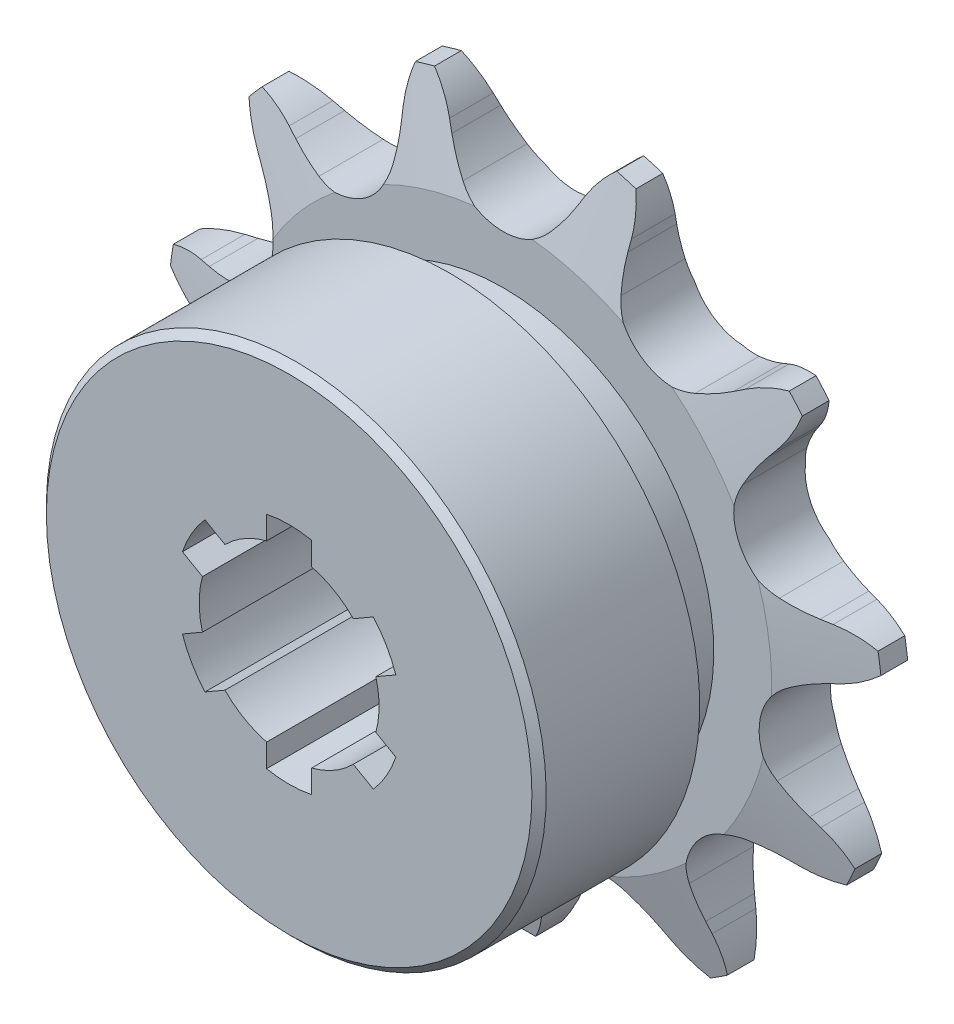
from build123d import *

# Parameters (mm, degrees)
CUT_EXTRUDE1_DEPTH      = 46.077076136
CIRPATTERN1_COUNT       = 11
BOSS_EXTRUDE1_START     = 3.175
SKETCH2_R               = 22.225
BOSS_EXTRUDE1_DEPTH     = 19.05
CUT_EXTRUDE2_DEPTH      = 51.025371879
CUT_EXTRUDE2_DEPTH_BACK = 51.025371879
SKETCH3_R               = 7.9375
SKETCH4_W               = 4.7625
SKETCH4_H               = 13.081
SKETCH5_R               = 7.9375
CUT_EXTRUDE3_DEPTH      = 52.514533936


with BuildPart() as part:
    # Sketch1 → Revolve1 (revolve)
    with BuildSketch(Plane(origin=(0, 0, 0), x_dir=(0, 0, -1), z_dir=(1, 0, 0)), mode=Mode.PRIVATE) as revolve1_sk:
        Polygon((3.175, 0), (-3.175, 0), (-3.175, 23.857642459), (-1.190625, 31.795142459), (1.190625, 31.795142459), (3.175, 23.857642459), align=None)
    revolve(revolve1_sk.sketch.rotate(Axis((0, 0, -3.175), (0, 0, 1)), 90), axis=Axis((0, 0, -3.175), (0, 0, 1)))

    # Sketch0 → Cut-Extrude1 (cut, symmetric)
    with BuildSketch(Plane.XY):
        with BuildLine():
            Line((13.704056458, -25.310310757), (13.050398427, -24.631275233))
            ThreePointArc((13.050398427, -24.631275233), (11.95512537, -23.614779328), (10.752525531, -22.727851696))
            ThreePointArc((10.752525531, -22.727851696), (6.488408594, -22.097490349), (3.24200423, -24.933139726))
            ThreePointArc((3.24200423, -24.933139726), (2.709822147, -26.329445289), (2.337978996, -27.776725382))
            Line((2.337978996, -27.776725382), (2.155201188, -28.701360627))
            ThreePointArc((2.155201188, -28.701360627), (-1.617083023, -34.260607897), (-8.235613288, -35.414044291))
            ThreePointArc((-8.235613288, -35.414044291), (10.243525573, -34.886244325), (26.074516628, -25.339681171))
            ThreePointArc((26.074516628, -25.339681171), (19.883059866, -27.947596343), (13.704056458, -25.310310757))
        make_face()
    cut_extrude1 = extrude(amount=CUT_EXTRUDE1_DEPTH, both=True, mode=Mode.SUBTRACT)

    # CirPattern1: Cut-Extrude1 ×11 about axis
    cirpattern1_axis = Axis((0, 0, 0), (0, 0, 1))
    for i in range(1, CIRPATTERN1_COUNT):
        add(cut_extrude1.rotate(cirpattern1_axis, i * 360 / CIRPATTERN1_COUNT), mode=Mode.SUBTRACT)

    # Sketch2 → Boss-Extrude1 (add)
    with BuildSketch(Plane.XY.offset(BOSS_EXTRUDE1_START)):
        Circle(SKETCH2_R)
    extrude(amount=BOSS_EXTRUDE1_DEPTH)

    # Sketch3 → Cut-Extrude2 (cut, two sides: drawn at the far end of the back side and taken through both)
    with BuildSketch(Plane.XY.offset(-CUT_EXTRUDE2_DEPTH_BACK)):
        Circle(SKETCH3_R)
    extrude(amount=CUT_EXTRUDE2_DEPTH + CUT_EXTRUDE2_DEPTH_BACK, mode=Mode.SUBTRACT)

    # Sketch4 → Cut-Revolve1 (revolve, cut)
    with BuildSketch(Plane(origin=(0, 0, 0), x_dir=(0, 0, -1), z_dir=(1, 0, 0))):
        Polygon((-22.225, 22.225), (-22.225, 21.59), (-21.59, 22.225), align=None)
        with Locations((-5.55625, 25.254642459)):
            Rectangle(SKETCH4_W, SKETCH4_H)
    revolve(axis=Axis((0, 0, -3.175), (0, 0, 1)), mode=Mode.SUBTRACT)

    # Sketch5 → Cut-Extrude3 (cut, through all)
    with BuildSketch(Plane(origin=(0, 0, -3.175), x_dir=(-1, 0, 0), z_dir=(0, 0, -1))):
        with BuildLine():
            ThreePointArc((7.485281374, -6.631030293), (8.660254038, -5), (9.485281374, -3.166928678))
            Line((9.485281374, -3.166928678), (7.708203933, -2.140932539))
            ThreePointArc((7.708203933, -2.140932539), (8, 0), (7.708203933, 2.140932539))
            Line((7.708203933, 2.140932539), (9.485281374, 3.166928678))
            ThreePointArc((9.485281374, 3.166928678), (8.660254038, 5), (7.485281374, 6.631030293))
            Line((7.485281374, 6.631030293), (5.708203933, 5.605034154))
            ThreePointArc((5.708203933, 5.605034154), (4, 6.92820323), (2, 7.745966692))
            Line((2, 7.745966692), (2, 9.797958971))
            ThreePointArc((2, 9.797958971), (0, 10), (-2, 9.797958971))
            Line((-2, 9.797958971), (-2, 7.745966692))
            ThreePointArc((-2, 7.745966692), (-4, 6.92820323), (-5.708203932, 5.605034154))
            Line((-5.708203932, 5.605034154), (-7.485281374, 6.631030293))
            ThreePointArc((-7.485281374, 6.631030293), (-8.660254038, 5), (-9.485281374, 3.166928678))
            Line((-9.485281374, 3.166928678), (-7.708203932, 2.140932539))
            ThreePointArc((-7.708203932, 2.140932539), (-8, 0), (-7.708203932, -2.140932539))
            Line((-7.708203932, -2.140932539), (-9.485281374, -3.166928678))
            ThreePointArc((-9.485281374, -3.166928678), (-8.660254038, -5), (-7.485281374, -6.631030293))
            Line((-7.485281374, -6.631030293), (-5.708203932, -5.605034154))
            ThreePointArc((-5.708203932, -5.605034154), (-4, -6.92820323), (-2, -7.745966692))
            Line((-2, -7.745966692), (-2, -9.797958971))
            ThreePointArc((-2, -9.797958971), (0, -10), (2, -9.797958971))
            Line((2, -9.797958971), (2, -7.745966692))
            ThreePointArc((2, -7.745966692), (4, -6.92820323), (5.708203933, -5.605034154))
            Line((5.708203933, -5.605034154), (7.485281374, -6.631030293))
        make_face()
        Circle(SKETCH5_R, mode=Mode.SUBTRACT)
    extrude(amount=-CUT_EXTRUDE3_DEPTH, mode=Mode.SUBTRACT)


solid = part.part
